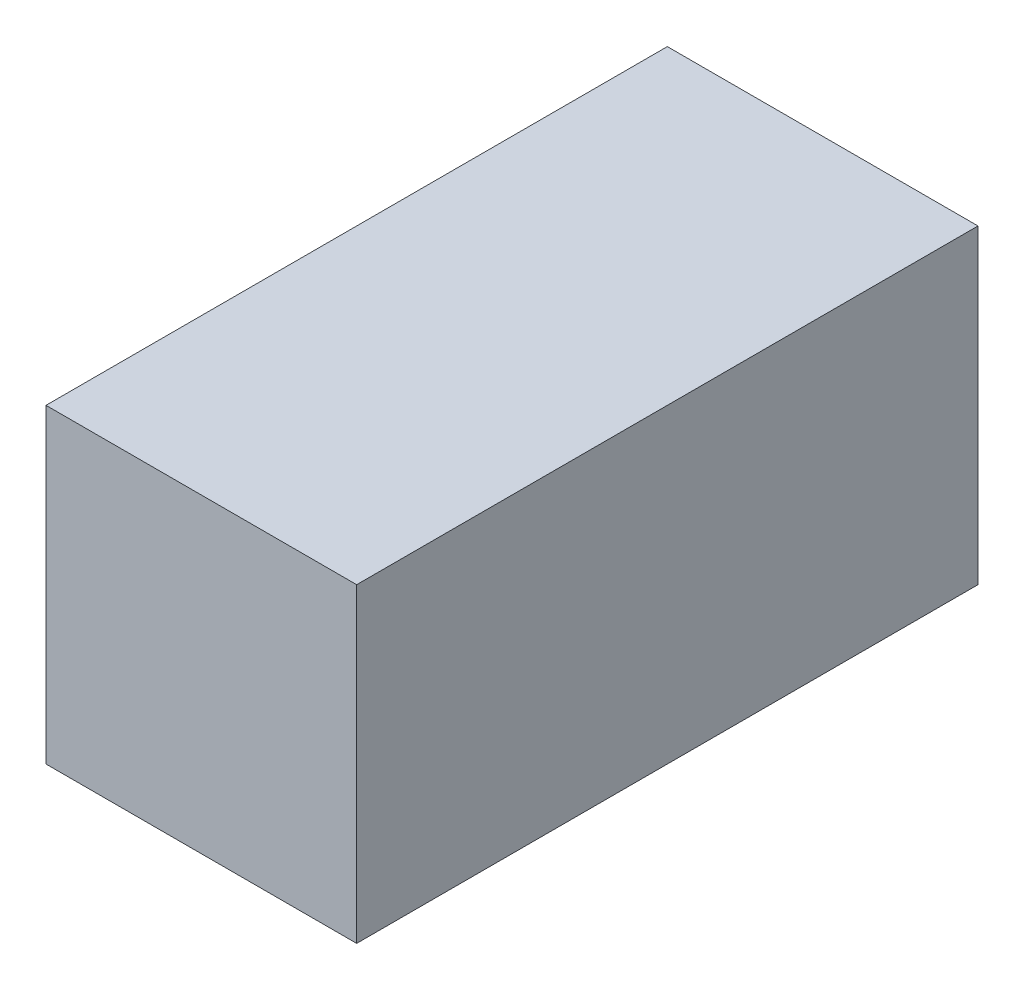
from build123d import *

# Parameters (mm, degrees)
SKETCH1_W           = 10
SKETCH1_H           = 20
BOSS_EXTRUDE1_DEPTH = 5


with BuildPart() as part:
    # Sketch1 → Boss-Extrude1 (new, symmetric)
    with BuildSketch(Plane(origin=(0, 0, 0), x_dir=(1, 0, 0), z_dir=(0, 1, 0))):
        Rectangle(SKETCH1_W, SKETCH1_H)
    extrude(amount=BOSS_EXTRUDE1_DEPTH, both=True)


solid = part.part
